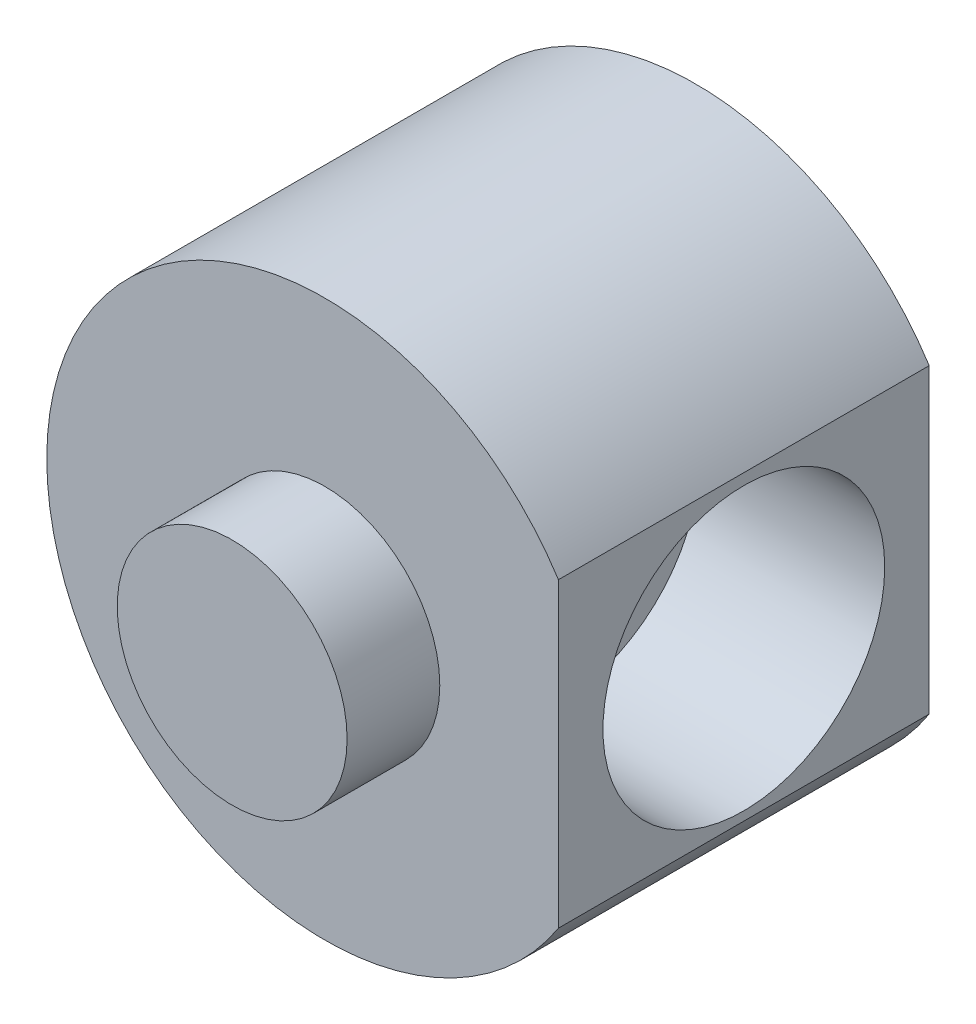
from build123d import *

# Parameters (mm, degrees)
CUT_EXTRUDE1_DEPTH = 12.7
SKETCH3_R          = 3.175
CUT_EXTRUDE2_DEPTH = 28.582400204
SKETCH3_3_R        = 4.826
SKETCH3_3_R_2      = 3.175
CUT_EXTRUDE3_DEPTH = 6.35


with BuildPart() as part:
    # Sketch1 → Revolve1 (revolve)
    with BuildSketch(Plane(origin=(0, 0, 0), x_dir=(1, 0, 0), z_dir=(0, 1, 0))):
        Polygon((0, 0), (3.937, 0), (3.937, -3.175), (9.525, -3.175), (9.525, -15.875), (3.937, -15.875), (3.937, -19.05), (0, -19.05), align=None)
    revolve(axis=Axis((0, 0, 19.05), (0, 0, -1)))

    # Sketch2 → Cut-Extrude1 (cut)
    with BuildSketch(Plane.XY.offset(15.875)):
        Polygon((8.001, 60.908660379), (8.001, 5.168135447), (8.001, 0), (8.001, -5.168135447), (8.001, -60.908660379), (119.482049864, -60.908660379), (119.482049864, 60.908660379), align=None)
    extrude(amount=-CUT_EXTRUDE1_DEPTH, mode=Mode.SUBTRACT)

    # Sketch3 → Cut-Extrude2 (cut, through all)
    with BuildSketch(Plane(origin=(8.001, 0, 0), x_dir=(0, 0, -1), z_dir=(1, 0, 0))):
        with Locations((-9.525, -0.038864553)):
            Circle(SKETCH3_R)
    extrude(amount=-CUT_EXTRUDE2_DEPTH, mode=Mode.SUBTRACT)

    # Sketch3<3> → Cut-Extrude3 (cut)
    with BuildSketch(Plane(origin=(8.001, 0, 0), x_dir=(0, 0, -1), z_dir=(1, 0, 0))):
        with Locations((-9.525, -0.038864553)):
            Circle(SKETCH3_3_R)
        with Locations((-9.525, -0.038864553)):
            Circle(SKETCH3_3_R_2, mode=Mode.SUBTRACT)
    extrude(amount=-CUT_EXTRUDE3_DEPTH, mode=Mode.SUBTRACT)


solid = part.part
